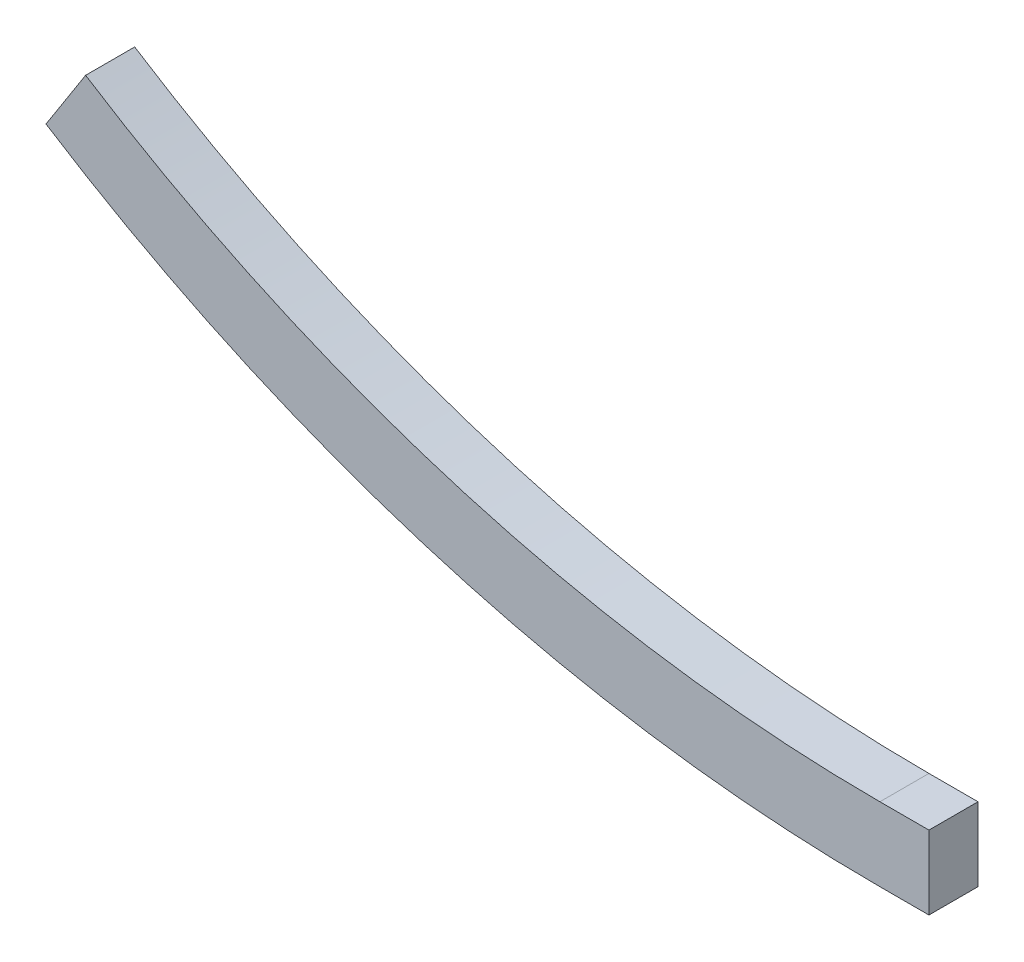
from build123d import *

# Parameters (mm, degrees)
BOSS_EXTRU_1_DEPTH = 10


with BuildPart() as part:
    # Esquisse2 → Boss.-Extru.1 (new body)
    with BuildSketch(Plane.XY):
        with BuildLine():
            Line((0, 0), (8.075458452, 12.640687117))
            ThreePointArc((8.075458452, 12.640687117), (85.653183343, -22.594420352), (170, -34.65388624))
            Line((170, -34.65388624), (180, -34.65388624))
            Line((180, -34.65388624), (180, -49.653886398))
            Line((180, -49.653886398), (170, -49.653886398))
            ThreePointArc((170, -49.653886398), (81.44665904, -36.992515867), (0, 0))
        make_face()
    extrude(amount=BOSS_EXTRU_1_DEPTH)


solid = part.part
